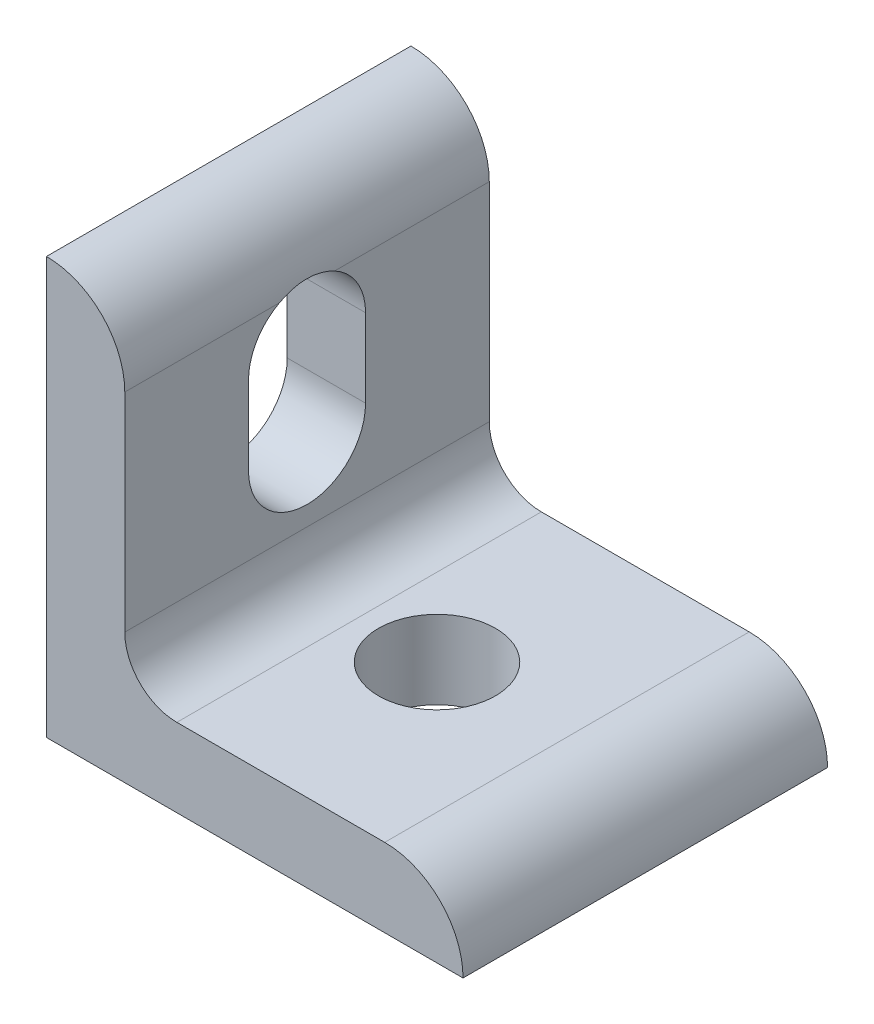
from build123d import *

# Parameters (mm, degrees)
BOSS_EXTRUDE1_DEPTH      = 11.1125
BOSS_EXTRUDE1_DEPTH_BACK = 11.1125
CUT_EXTRUDE1_DEPTH       = 27.648827953
CUT_EXTRUDE1_DEPTH_BACK  = 27.648827953
SKETCH6_R                = 3.5687
CUT_EXTRUDE2_DEPTH       = 27.64882812


with BuildPart() as part:
    # Sketch4 → Boss-Extrude1 (new, two sides: drawn at the far end of the back side and taken through both)
    with BuildSketch(Plane.XY.offset(-BOSS_EXTRUDE1_DEPTH_BACK)):
        with BuildLine():
            Line((-12.7, 12.7), (-12.7, -12.7))
            Line((-12.7, -12.7), (12.7, -12.7))
            ThreePointArc((12.7, -12.7), (11.301376302, -9.323423698), (7.9248, -7.9248))
            Line((7.9248, -7.9248), (-4.7498, -7.9248))
            ThreePointArc((-4.7498, -7.9248), (-6.99486403, -6.99486403), (-7.9248, -4.7498))
            Line((-7.9248, -4.7498), (-7.9248, 7.9248))
            ThreePointArc((-7.9248, 7.9248), (-9.323423698, 11.301376302), (-12.7, 12.7))
        make_face()
    extrude(amount=BOSS_EXTRUDE1_DEPTH + BOSS_EXTRUDE1_DEPTH_BACK)

    # Sketch5 → Cut-Extrude1 (cut, two sides: drawn at the far end of the back side and taken through both)
    with BuildSketch(Plane(origin=(-7.9248, 0, 0), x_dir=(0, 0, -1), z_dir=(1, 0, 0)).offset(-CUT_EXTRUDE1_DEPTH_BACK)):
        with BuildLine():
            Line((3.5687, 4.7752), (3.5687, 0))
            ThreePointArc((3.5687, 0), (0, -3.5687), (-3.5687, 0))
            Line((-3.5687, 0), (-3.5687, 4.7752))
            ThreePointArc((-3.5687, 4.7752), (0, 8.3439), (3.5687, 4.7752))
        make_face()
    extrude(amount=CUT_EXTRUDE1_DEPTH + CUT_EXTRUDE1_DEPTH_BACK, mode=Mode.SUBTRACT)

    # Sketch6 → Cut-Extrude2 (cut, through all)
    with BuildSketch(Plane(origin=(0, -7.9248, 0), x_dir=(1, 0, 0), z_dir=(0, 1, 0))):
        with Locations(Location((0, 0, 0), (0, 0, 180))):
            Circle(SKETCH6_R)
    extrude(amount=-CUT_EXTRUDE2_DEPTH, mode=Mode.SUBTRACT)


solid = part.part
